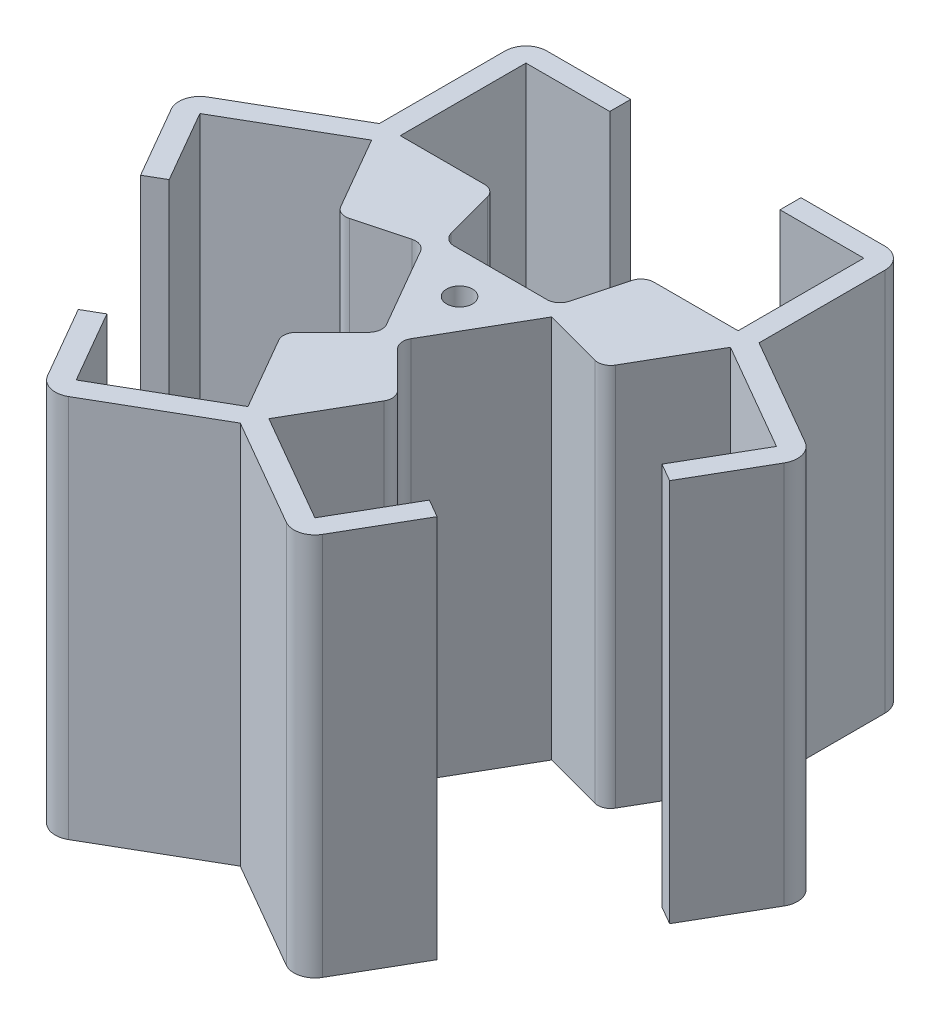
from build123d import *

# Parameters (mm, degrees)
SALIENTE_EXTRUIR1_DEPTH = 88.9
CROQUIS4_R              = 2.999994
CORTAR_EXTRUIR1_DEPTH   = 112.44204772
REDONDEO6_R             = 3
REDONDEO7_R             = 3
ESCALA2_SCALE           = 1.03
SALIENTE_EXTRUIR2_DEPTH = 91.567


with BuildPart() as part:
    # Croquis1 → Saliente-Extruir1 (new body)
    with BuildSketch(Plane(origin=(0, 0, 0), x_dir=(1, 0, 0), z_dir=(0, 1, 0))):
        Polygon((1.696358741, -16.064461222), (13.335, -27.703102481), (0, -50.8), (-13.335, -27.703102481), (-1.696358741, -16.064461222), (-14.760410887, 6.563140847), (-30.659090512, 2.303102481), (-43.994090512, 25.4), (-17.324090512, 25.4), (-13.064052146, 9.501320374), (13.064052146, 9.501320374), (17.324090512, 25.4), (43.994090512, 25.4), (30.659090512, 2.303102481), (14.760410887, 6.563140847), align=None)
    extrude(amount=SALIENTE_EXTRUIR1_DEPTH)

    # Croquis4 → Cortar-Extruir1 (cut, through all)
    with BuildSketch(Plane(origin=(0, 88.9, 0), x_dir=(1, 0, 0), z_dir=(0, 1, 0))):
        with Locations(Location((0, 0, 0), (0, 0, 270))):
            Circle(CROQUIS4_R)
    extrude(amount=-CORTAR_EXTRUIR1_DEPTH, mode=Mode.SUBTRACT)

    # Redondeo6
    redondeo6_edges = [part.edges().sort_by_distance(p)[0] for p in [
        (-1.696358741, 44.45, 16.064461222),
        (-14.760410887, 44.45, -6.563140847),
        (-13.064052146, 44.45, -9.501320374),
        (13.064052146, 44.45, -9.501320374),
        (1.696358741, 44.45, 16.064461222),
    ]]
    fillet(redondeo6_edges, radius=REDONDEO6_R)

    # Redondeo7
    redondeo7_edges = [part.edges().sort_by_distance(p)[0] for p in [
        (-13.335, 44.45, 27.703102481),
        (-30.659090512, 44.45, -2.303102481),
        (-17.324090512, 44.45, -25.4),
        (17.324090512, 44.45, -25.4),
        (30.659090512, 44.45, -2.303102481),
        (13.335, 44.45, 27.703102481),
    ]]
    fillet(redondeo7_edges, radius=REDONDEO7_R)


with BuildPart() as part_1:
    # Escala2: scaled about (-0.008124988, 44.45, 0.003254237)
    add(part.part.scale(ESCALA2_SCALE).moved(Location((0.00024375, -1.3335, -9.7627e-05))))

    # Croquis17 → Saliente-Extruir2 (add, through all)
    with BuildSketch(Plane(origin=(0, 90.2335, 0), x_dir=(1, 0, 0), z_dir=(0, 1, 0))):
        with BuildLine():
            Line((-45.313669478, 56.162097627), (-45.313669478, 26.162097627))
            Line((-45.313669478, 26.162097627), (-40.313669478, 26.162097627))
            Line((-40.313669478, 26.162097627), (-40.313669478, 56.162097627))
            Line((-40.313669478, 56.162097627), (-20.313669478, 56.162097627))
            Line((-20.313669478, 56.162097627), (-20.313669478, 61.162097627))
            Line((-20.313669478, 61.162097627), (-40.313669478, 61.162097627))
            ThreePointArc((-40.313669478, 61.162097627), (-43.849203384, 59.697631533), (-45.313669478, 56.162097627))
        make_face()
        with BuildLine():
            Line((-42.813529111, 21.831727485), (-45.313669478, 26.162097627))
            Line((-45.313669478, 26.162097627), (-71.294291224, 11.161854504))
            ThreePointArc((-71.294291224, 11.161854504), (-73.623920356, 8.125822711), (-73.124418243, 4.331727485))
            Line((-73.124418243, 4.331727485), (-63.124418243, -12.988780591))
            Line((-63.124418243, -12.988780591), (-58.794291224, -10.488780591))
            Line((-58.794291224, -10.488780591), (-68.794291224, 6.831727485))
            Line((-68.794291224, 6.831727485), (-42.813529111, 21.831727485))
        make_face()
        with BuildLine():
            Line((20.313669478, 56.162097627), (40.313669478, 56.162097627))
            Line((40.313669478, 56.162097627), (40.313669478, 26.162097627))
            Line((40.313669478, 26.162097627), (45.313669478, 26.162097627))
            Line((45.313669478, 26.162097627), (45.313669478, 56.162097627))
            ThreePointArc((45.313669478, 56.162097627), (43.849203384, 59.697631533), (40.313669478, 61.162097627))
            Line((40.313669478, 61.162097627), (20.313669478, 61.162097627))
            Line((20.313669478, 61.162097627), (20.313669478, 56.162097627))
        make_face()
        with BuildLine():
            Line((71.294712326, 11.162097627), (45.313669478, 26.162097627))
            Line((45.313669478, 26.162097627), (42.813950212, 21.831970608))
            Line((42.813950212, 21.831970608), (68.794712326, 6.831970608))
            Line((68.794712326, 6.831970608), (58.794712326, -10.488537468))
            Line((58.794712326, -10.488537468), (63.124839345, -12.988537468))
            Line((63.124839345, -12.988537468), (73.124839345, 4.331970608))
            ThreePointArc((73.124839345, 4.331970608), (73.624341457, 8.126065834), (71.294712326, 11.162097627))
        make_face()
        with BuildLine():
            Line((38.481042848, -45.672845092), (28.481042848, -62.993353167))
            Line((28.481042848, -62.993353167), (2.500280734, -47.993353167))
            Line((2.500280734, -47.993353167), (0.000280734, -52.323480186))
            Line((0.000280734, -52.323480186), (25.981042848, -67.323480186))
            ThreePointArc((25.981042848, -67.323480186), (29.775138073, -67.822982299), (32.811169867, -65.493353167))
            Line((32.811169867, -65.493353167), (42.811169867, -48.172845092))
            Line((42.811169867, -48.172845092), (38.481042848, -45.672845092))
        make_face()
        with BuildLine():
            Line((-25.980621746, -67.323723309), (0.000280734, -52.323480186))
            Line((0.000280734, -52.323480186), (-2.499859633, -47.99359629))
            Line((-2.499859633, -47.99359629), (-28.480621746, -62.99359629))
            Line((-28.480621746, -62.99359629), (-38.480621746, -45.673088215))
            Line((-38.480621746, -45.673088215), (-42.810748765, -48.173088215))
            Line((-42.810748765, -48.173088215), (-32.810748765, -65.49359629))
            ThreePointArc((-32.810748765, -65.49359629), (-29.774716972, -67.823225422), (-25.980621746, -67.323723309))
        make_face()
    extrude(amount=-SALIENTE_EXTRUIR2_DEPTH)


solid = part_1.part
